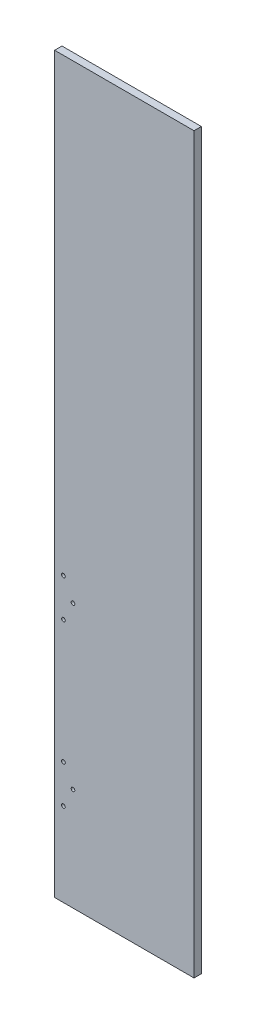
from build123d import *

# Parameters (mm, degrees)
SKETCH1_W           = 190
SKETCH1_H           = 1000
BOSS_EXTRUDE1_DEPTH = 10
SKETCH2_R           = 2.5
CUT_EXTRUDE1_DEPTH  = 510.043220169


with BuildPart() as part:
    # Sketch1 → Boss-Extrude1 (new body)
    with BuildSketch(Plane.XY):
        Rectangle(SKETCH1_W, SKETCH1_H)
    extrude(amount=BOSS_EXTRUDE1_DEPTH)

    # Sketch2 → Cut-Extrude1 (cut, through all)
    with BuildSketch(Plane.XY.offset(10)):
        with Locations((-83, -386)):
            Circle(SKETCH2_R)
        with Locations((-70, -360)):
            Circle(SKETCH2_R)
        with Locations((-83, -334)):
            Circle(SKETCH2_R)
        with Locations((-83, -166)):
            Circle(SKETCH2_R)
        with Locations((-70, -140)):
            Circle(SKETCH2_R)
        with Locations((-83, -114)):
            Circle(SKETCH2_R)
    extrude(amount=-CUT_EXTRUDE1_DEPTH, mode=Mode.SUBTRACT)


solid = part.part
